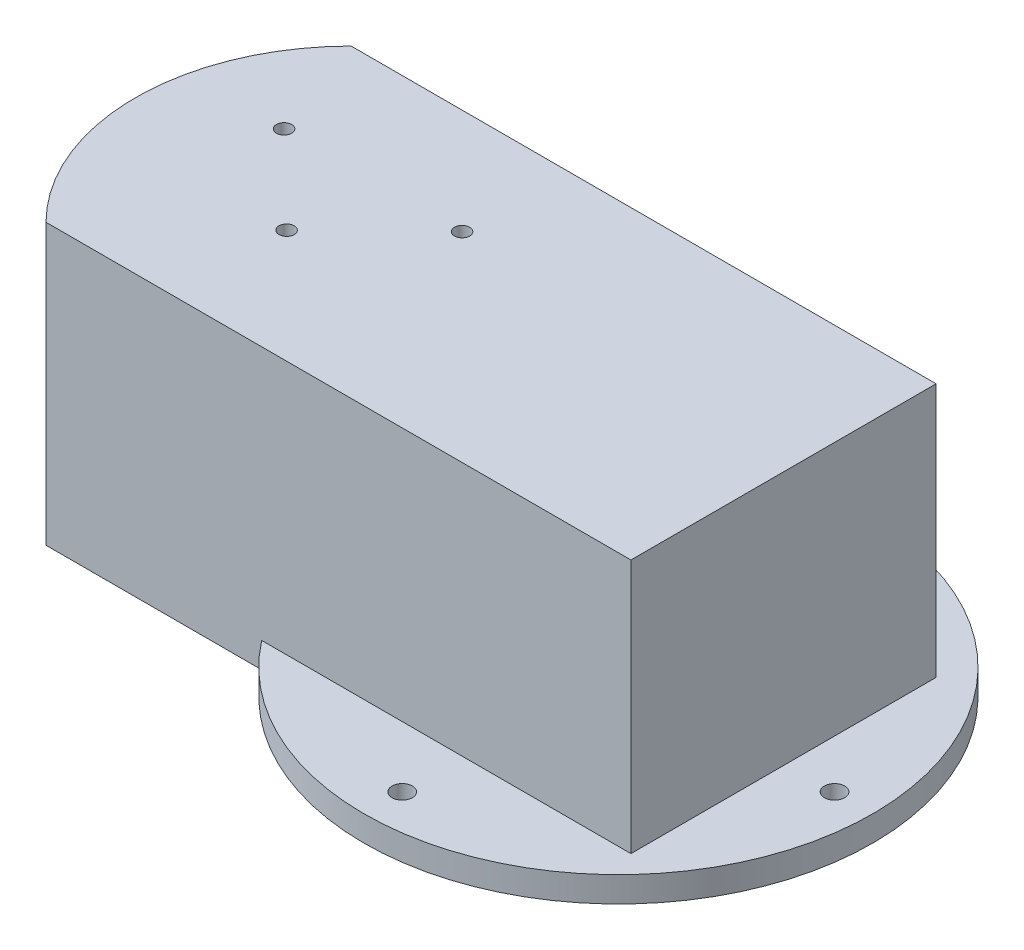
from build123d import *

# Parameters (mm, degrees)
SKETCH1_R                = 50
BOSS_EXTRUDE1_DEPTH      = 5
BOSS_EXTRUDE2_DEPTH      = 50
BOSS_EXTRUDE2_DEPTH_BACK = 5
SKETCH3_R                = 2
CUT_EXTRUDE1_DEPTH       = 50
BOSS_EXTRUDE3_DEPTH      = 55
SKETCH5_R                = 1.5
CUT_EXTRUDE2_DEPTH       = 55


with BuildPart() as part:
    # Sketch1 → Boss-Extrude1 (new body)
    with BuildSketch(Plane(origin=(0, 0, 0), x_dir=(1, 0, 0), z_dir=(0, 1, 0))):
        with Locations(Location((0, 0, 0), (0, 0, 270))):
            Circle(SKETCH1_R)
    extrude(amount=BOSS_EXTRUDE1_DEPTH)

    # Sketch2 → Boss-Extrude2 (add, two sides: drawn at the far end of the back side and taken through both)
    with BuildSketch(Plane(origin=(0, 5, 0), x_dir=(1, 0, 0), z_dir=(0, 1, 0)).offset(-BOSS_EXTRUDE2_DEPTH_BACK)):
        with BuildLine():
            ThreePointArc((-40.394880662, 29.46614356), (-49.995546188, -0.667353994), (-39.593984529, -30.53385644))
            Line((-39.593984529, -30.53385644), (33, -30.53385644))
            Line((33, -30.53385644), (33, 29.46614356))
            Line((33, 29.46614356), (-40.394880662, 29.46614356))
        make_face()
        with BuildLine():
            Line((-82, 29.46614356), (-82, -30.53385644))
            Line((-82, -30.53385644), (-39.593984529, -30.53385644))
            ThreePointArc((-39.593984529, -30.53385644), (-49.995546188, -0.667353994), (-40.394880662, 29.46614356))
            Line((-40.394880662, 29.46614356), (-82, 29.46614356))
        make_face()
    extrude(amount=BOSS_EXTRUDE2_DEPTH + BOSS_EXTRUDE2_DEPTH_BACK)

    # Sketch3 → Cut-Extrude1 (cut)
    with BuildSketch(Plane(origin=(0, 5, 0), x_dir=(1, 0, 0), z_dir=(0, 1, 0))):
        with Locations(Location((0, -42.5, 0), (0, 0, 270))):
            Circle(SKETCH3_R)
        with Locations(Location((-42.5, 0, 0), (0, 0, 270))):
            Circle(SKETCH3_R)
        with Locations(Location((0, 42.5, 0), (0, 0, 270))):
            Circle(SKETCH3_R)
        with Locations(Location((42.5, 0, 0), (0, 0, 270))):
            Circle(SKETCH3_R)
    extrude(amount=-CUT_EXTRUDE1_DEPTH, mode=Mode.SUBTRACT)

    # Sketch4 → Boss-Extrude3 (add)
    with BuildSketch(Plane(origin=(0, 55, 0), x_dir=(1, 0, 0), z_dir=(0, 1, 0))):
        with BuildLine():
            Line((-82, 29.46614356), (-82, -30.53385644))
            ThreePointArc((-82, -30.53385644), (-94.426406871, -0.53385644), (-82, 29.46614356))
        make_face()
    extrude(amount=-BOSS_EXTRUDE3_DEPTH)

    # Sketch5 → Cut-Extrude2 (cut)
    with BuildSketch(Plane(origin=(0, 55, 0), x_dir=(1, 0, 0), z_dir=(0, 1, 0))):
        with Locations(Location((-74.5, 8.768970361, 0), (0, 0, 270))):
            Circle(SKETCH5_R)
        with Locations(Location((-39.5, 8.768970361, 0), (0, 0, 270))):
            Circle(SKETCH5_R)
        with Locations(Location((-57, -8.231029639, 0), (0, 0, 270))):
            Circle(SKETCH5_R)
    extrude(amount=-CUT_EXTRUDE2_DEPTH, mode=Mode.SUBTRACT)


solid = part.part
